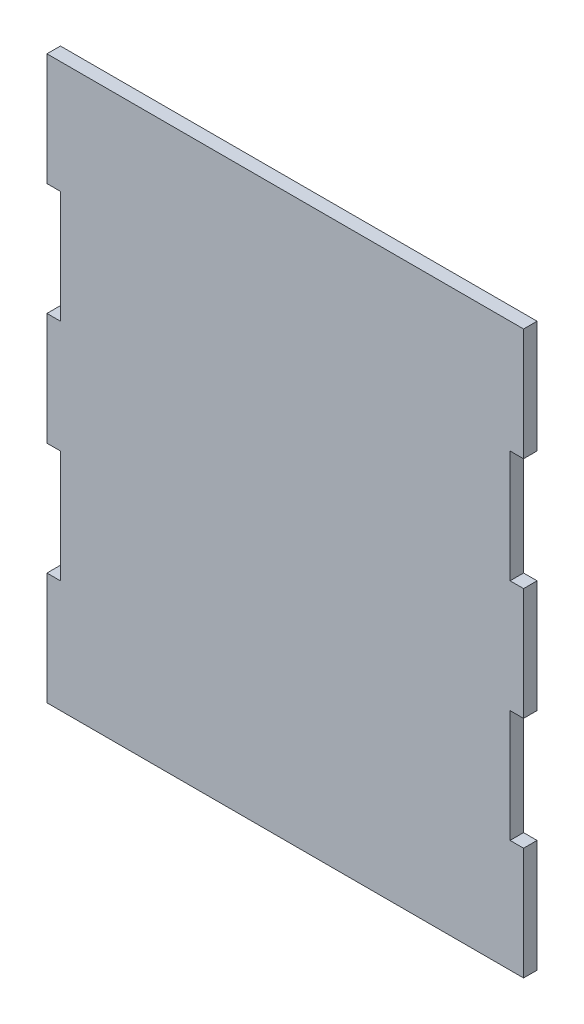
from build123d import *

# Parameters (mm, degrees)
SALIENTE_EXTRUIR1_DEPTH = 3


with BuildPart() as part:
    # Croquis1 → Saliente-Extruir1 (new body)
    with BuildSketch(Plane.XY):
        Polygon((-53, 0), (53, 0), (53, -25), (50, -25), (50, -50), (53, -50.000000156), (53, -75.000000156), (50, -75.000000156), (50, -100.000000156), (53, -100.000000312), (53, -125.000000312), (-53, -125.000000312), (-53, -100.000000312), (-50, -100.000000156), (-50, -75.000000156), (-53, -75.000000156), (-53, -50.000000156), (-50, -50), (-50, -25), (-53, -25), align=None)
    extrude(amount=SALIENTE_EXTRUIR1_DEPTH)


solid = part.part
